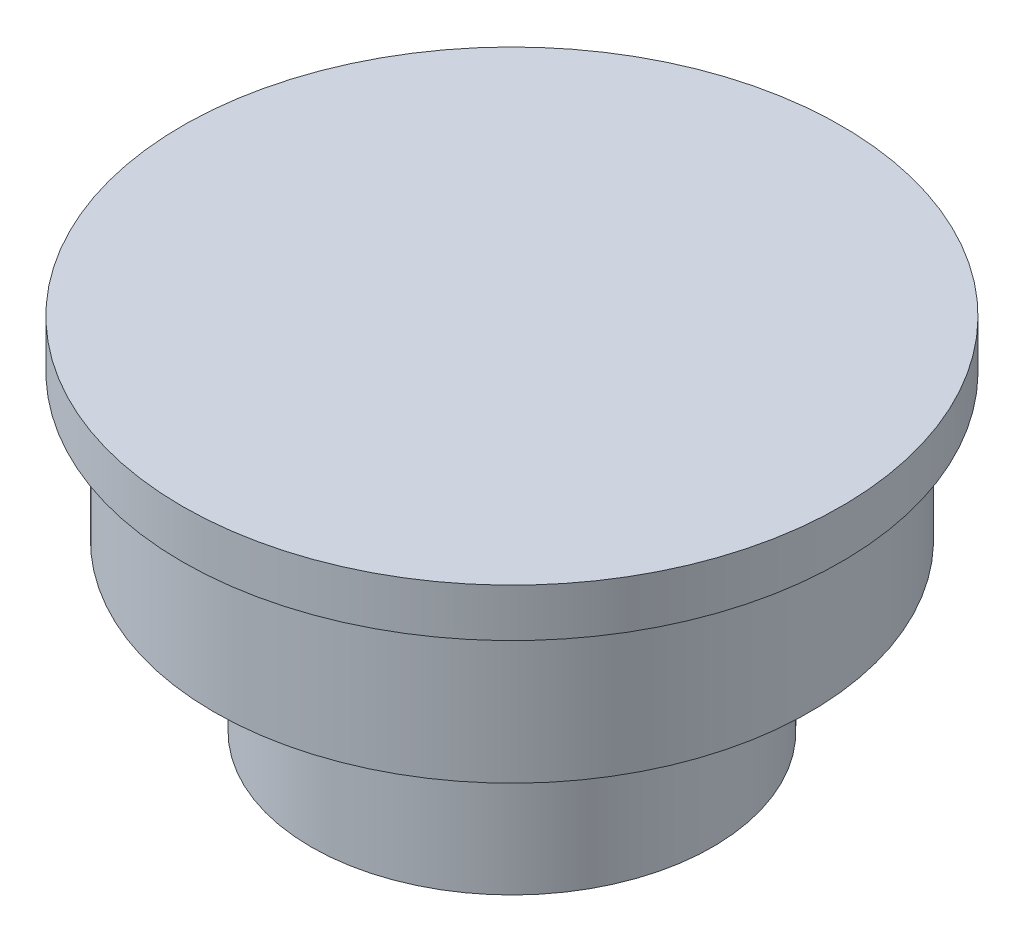
from build123d import *


with BuildPart() as part:
    # Sketch1 → Revolve1 (revolve)
    with BuildSketch(Plane.XY, mode=Mode.PRIVATE) as revolve1_sk:
        Polygon((0, 0), (12.125, 0), (12.125, 10), (18, 10), (18, 18.8), (19.9, 18.8), (19.9, 21.7), (0, 21.7), align=None)
    revolve(revolve1_sk.sketch.rotate(Axis((0, 21.7, 0), (0, -1, 0)), 90), axis=Axis((0, 21.7, 0), (0, -1, 0)))


solid = part.part
